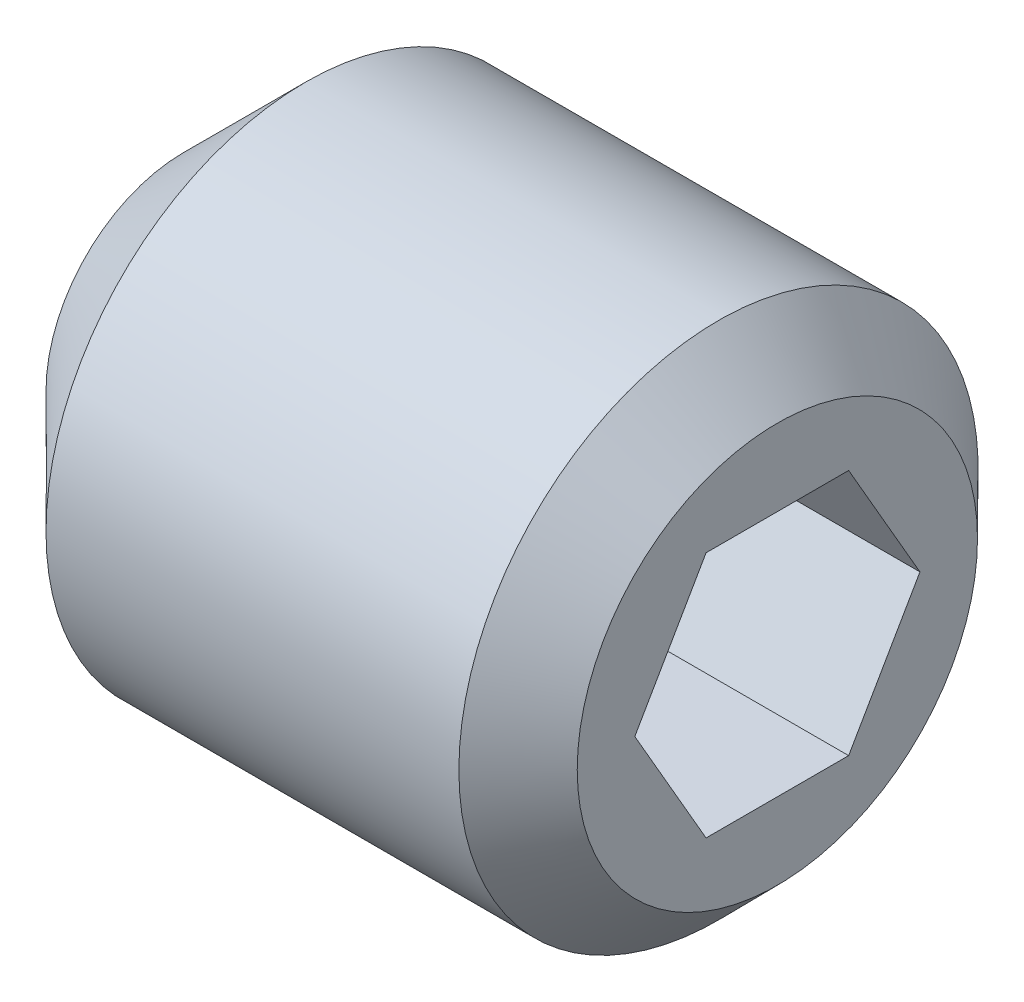
from build123d import *

# Parameters (mm, degrees)
SKETCH1_R           = 2.083
BOSS_EXTRUDE1_DEPTH = 4.762
CUT_EXTRUDE1_DEPTH  = 2.286


with BuildPart() as part:
    # Sketch1 → Boss-Extrude1 (new body)
    with BuildSketch(Plane(origin=(0, 0, 0), x_dir=(0, 0, -1), z_dir=(1, 0, 0))):
        with Locations(Location((0, 0, 0), (0, 0, 180))):
            Circle(SKETCH1_R)
    extrude(amount=BOSS_EXTRUDE1_DEPTH)

    # Sketch2 → Cut-Revolve1 (revolve, cut)
    with BuildSketch(Plane.XY, mode=Mode.PRIVATE) as cut_revolve1_sk:
        Polygon((0, 1.105), (0.978, 2.083), (0, 2.083), align=None)
    revolve(cut_revolve1_sk.sketch.rotate(Axis((4.762, 0, 0), (-1, 0, 0)), 270), axis=Axis((4.762, 0, 0), (-1, 0, 0)), mode=Mode.SUBTRACT)

    # Sketch3 → Cut-Revolve2 (revolve, cut)
    with BuildSketch(Plane.XY, mode=Mode.PRIVATE) as cut_revolve2_sk:
        Polygon((4.29, 2.083), (4.762, 2.083), (4.762, 1.6055), align=None)
    revolve(cut_revolve2_sk.sketch.rotate(Axis((4.762, 0, 0), (-1, 0, 0)), 270), axis=Axis((4.762, 0, 0), (-1, 0, 0)), mode=Mode.SUBTRACT)

    # Sketch11 → Cut-Revolve5 (revolve, cut)
    with BuildSketch(Plane.XY, mode=Mode.PRIVATE) as cut_revolve5_sk:
        Polygon((0, 0), (0, 1.105), (0.6, 0), align=None)
    revolve(cut_revolve5_sk.sketch.rotate(Axis((4.762, 0, 0), (-1, 0, 0)), 90), axis=Axis((4.762, 0, 0), (-1, 0, 0)), mode=Mode.SUBTRACT)

    # Sketch12 → Cut-Extrude1 (cut)
    with BuildSketch(Plane(origin=(4.762, 0, 0), x_dir=(0, 0, -1), z_dir=(1, 0, 0))):
        Polygon((0.571865442, 0.9905), (-0.571865442, 0.9905), (-1.143730883, 0), (-0.571865442, -0.9905), (0.571865442, -0.9905), (1.143730883, 0), align=None)
    extrude(amount=-CUT_EXTRUDE1_DEPTH, mode=Mode.SUBTRACT)


solid = part.part
